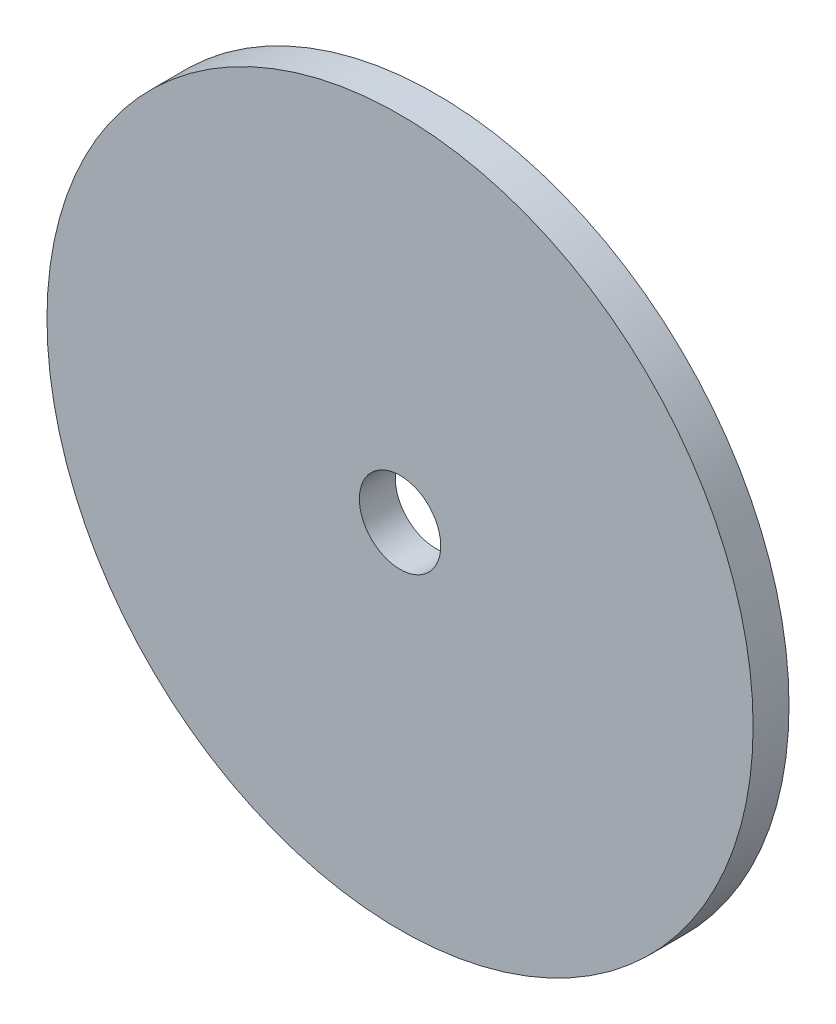
from build123d import *

# Parameters (mm, degrees)
MODEL_R             = 29.5
MODEL_R_2           = 3.4
BOSS_EXTRUDE1_DEPTH = 3


with BuildPart() as part:
    # Model → Boss-Extrude1 (new body)
    with BuildSketch(Plane.XY):
        Circle(MODEL_R)
        Circle(MODEL_R_2, mode=Mode.SUBTRACT)
    extrude(amount=BOSS_EXTRUDE1_DEPTH)


solid = part.part
